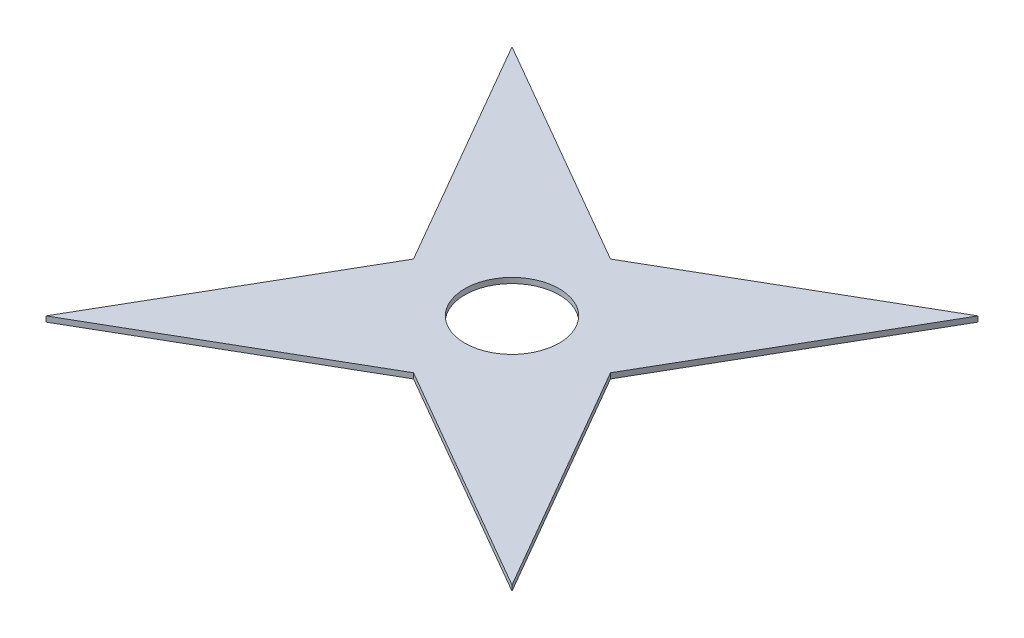
from build123d import *

# Parameters (mm, degrees)
SKETCH1_R           = 13.155
BOSS_EXTRUDE1_DEPTH = 1.5


with BuildPart() as part:
    # Sketch1 → Boss-Extrude1 (new body)
    with BuildSketch(Plane(origin=(0, 0, 0), x_dir=(1, 0, 0), z_dir=(0, 1, 0))):
        Polygon((0, 0), (37.5, 64.951905284), (0, 129.903810568), (64.951905284, 92.403810568), (129.903810568, 129.903810568), (92.403810568, 64.951905284), (129.903810568, 0), (64.951905284, 37.5), align=None)
        with Locations(Location((64.951905284, 64.951905284, 0), (0, 0, 270))):
            Circle(SKETCH1_R, mode=Mode.SUBTRACT)
    extrude(amount=BOSS_EXTRUDE1_DEPTH)


solid = part.part
